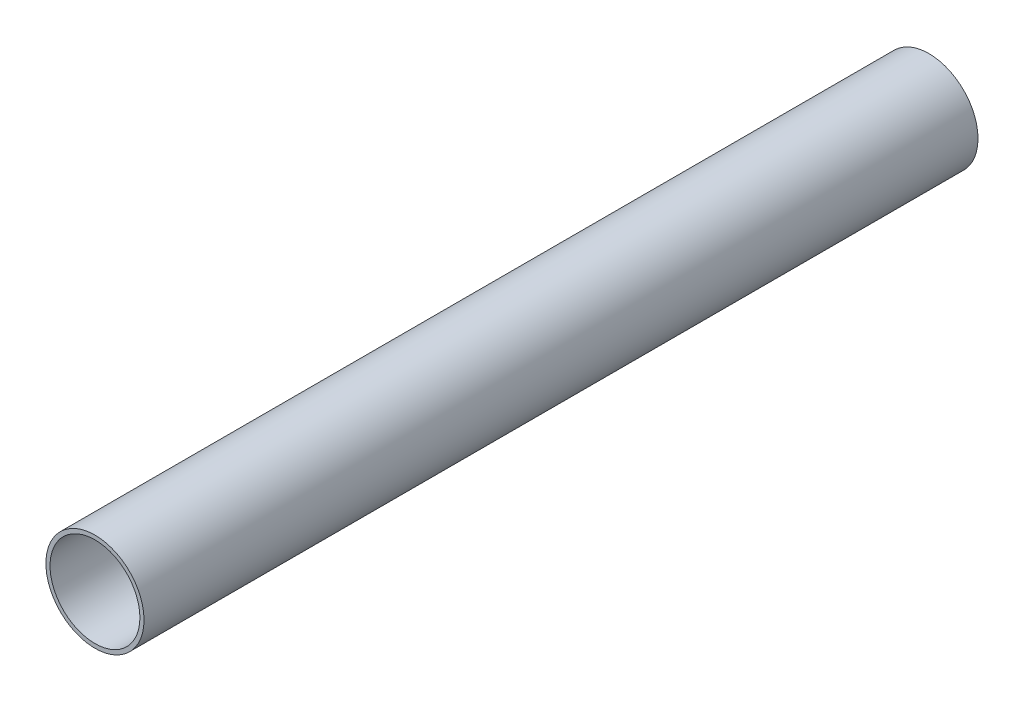
from build123d import *

# Parameters (mm, degrees)
SKETCH1_W = 1.0668
SKETCH1_H = 215.9


with BuildPart() as part:
    # Sketch1 → Revolve1 (revolve)
    with BuildSketch(Plane(origin=(0, 0, 0), x_dir=(1, 0, 0), z_dir=(0, 1, 0))):
        with Locations((12.1666, -107.95)):
            Rectangle(SKETCH1_W, SKETCH1_H)
    revolve(axis=Axis((0, 0, 0), (0, 0, -1)))


solid = part.part
